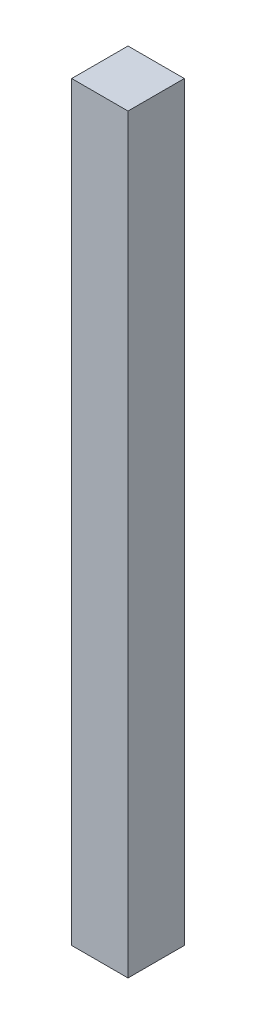
from build123d import *

# Parameters (mm, degrees)
SKETCH1_W           = 9.525
SKETCH1_H           = 9.525
BOSS_EXTRUDE1_DEPTH = 127


with BuildPart() as part:
    # Sketch1 → Boss-Extrude1 (new body)
    with BuildSketch(Plane(origin=(0, 0, 0), x_dir=(1, 0, 0), z_dir=(0, 1, 0))):
        Rectangle(SKETCH1_W, SKETCH1_H)
    extrude(amount=BOSS_EXTRUDE1_DEPTH)


solid = part.part
